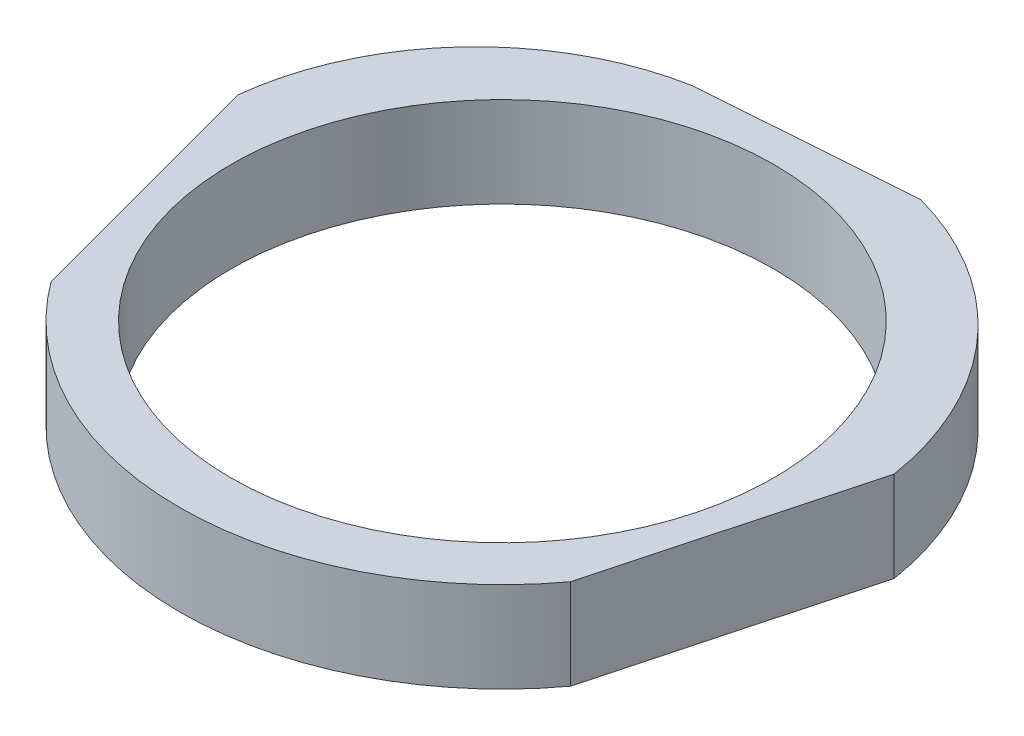
from build123d import *

# Parameters (mm, degrees)
SKETCH1_R           = 9
BOSS_EXTRUDE1_DEPTH = 1.5


with BuildPart() as part:
    # Sketch1 → Boss-Extrude1 (new, symmetric)
    with BuildSketch(Plane(origin=(0, 0, 0), x_dir=(1, 0, 0), z_dir=(0, 1, 0))):
        with BuildLine():
            Line((-8.613284174, -6.35), (-10.883410628, 2.104994632))
            ThreePointArc((-10.883410628, 2.104994632), (-8.533007766, 7.219663427), (-3.590944982, 9.91414778))
            Line((-3.590944982, 9.91414778), (3.443136374, 10.426476807))
            ThreePointArc((3.443136374, 10.426476807), (8.389040028, 7.361699028), (10.883410628, 2.104994632))
            Line((10.883410628, 2.104994632), (8.613284174, -6.35))
            ThreePointArc((8.613284174, -6.35), (0, -10.700988938), (-8.613284174, -6.35))
        make_face()
        with Locations(Location((0, 0, 0), (0, 0, 270))):
            Circle(SKETCH1_R, mode=Mode.SUBTRACT)
    extrude(amount=BOSS_EXTRUDE1_DEPTH, both=True)


solid = part.part
